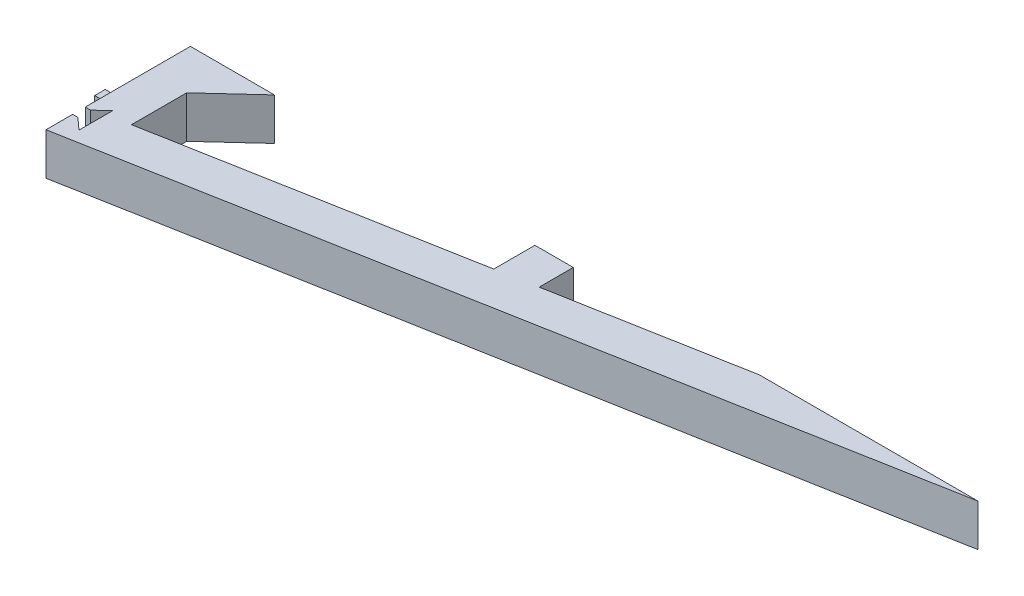
from build123d import *

# Parameters (mm, degrees)
P_IDAT_VYSUNUT_M1_DEPTH  = 8
ODEBRAT_VYSUNUT_M1_DEPTH = 153.557332159
SKICA3_W                 = 2
SKICA3_H                 = 2
P_IDAT_VYSUNUT_M2_DEPTH  = 4
SKICA5_W                 = 16
SKICA5_H                 = 8
P_IDAT_VYSUNUT_M4_DEPTH  = 8
ODEBRAT_VYSUNUT_M3_DEPTH = 153.557332159
SKICA8_R                 = 2.2
ODEBRAT_VYSUNUT_M4_DEPTH = 9.4


with BuildPart() as part:
    # Skica1 → Přidat vysunutím1 (new body)
    with BuildSketch(Plane(origin=(0, 0, 0), x_dir=(1, 0, 0), z_dir=(0, 1, 0))):
        Polygon((0, 0), (0, -27.47211487), (149.85, 0.000769495), (108.259653873, 0.000769495), (72.85, -6.491091207), (72.85, 0), (65.55, 0), (65.55, -7.829443265), (7.3, -18.508759343), (7.3, 0), align=None)
    extrude(amount=P_IDAT_VYSUNUT_M1_DEPTH)

    # Skica2 → Odebrat vysunutím1 (cut, through all)
    with BuildSketch(Plane(origin=(0, 8, 0), x_dir=(1, 0, 0), z_dir=(0, 1, 0))):
        Polygon((0, -20), (1, -20), (3.2, -18), (3.2, -24.4), (1, -22.4), (0, -22.4), align=None)
    extrude(amount=-ODEBRAT_VYSUNUT_M1_DEPTH, mode=Mode.SUBTRACT)

    # Skica3 → Přidat vysunutím2 (add)
    with BuildSketch(Plane.ZY):
        with Locations((13.2, 4)):
            Rectangle(SKICA3_W, SKICA3_H)
    extrude(amount=P_IDAT_VYSUNUT_M2_DEPTH)

    # Skica5 → Přidat vysunutím4 (add)
    with BuildSketch(Plane(origin=(0, 8, 0), x_dir=(1, 0, 0), z_dir=(0, 1, 0))):
        with Locations((8, -4)):
            Rectangle(SKICA5_W, SKICA5_H)
    extrude(amount=-P_IDAT_VYSUNUT_M4_DEPTH)

    # Skica7 → Odebrat vysunutím3 (cut, through all)
    with BuildSketch(Plane.XZ):
        Polygon((7.3, 8), (16, 8), (16, 0), align=None)
    extrude(amount=-ODEBRAT_VYSUNUT_M3_DEPTH, mode=Mode.SUBTRACT)

    # Skica8 → Odebrat vysunutím4 (cut)
    with BuildSketch(Plane(origin=(0, 0, 0), x_dir=(-1, 0, 0), z_dir=(0, 0, -1))):
        with Locations((-3.65, 4)):
            Circle(SKICA8_R)
        with Locations((-69.2, 4)):
            Circle(SKICA8_R)
    extrude(amount=-ODEBRAT_VYSUNUT_M4_DEPTH, mode=Mode.SUBTRACT)


solid = part.part
